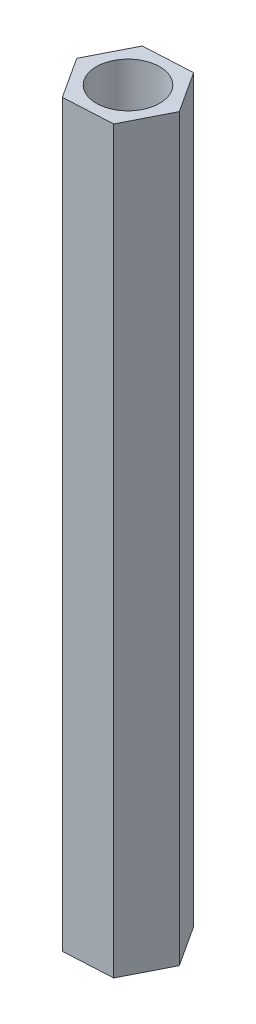
from build123d import *

# Parameters (mm, degrees)
SKETCH_1_R      = 1.5
EXTRUDE_1_DEPTH = 35


with BuildPart() as part:
    # 草图1 → 凸台-拉伸1 (new body)
    with BuildSketch(Plane(origin=(0, 0, 0), x_dir=(1, 0, 0), z_dir=(0, 1, 0))):
        Polygon((1.047736103, 2.058053059), (-1.25845818, 1.936392611), (-2.306194283, -0.121660448), (-1.047736103, -2.058053059), (1.25845818, -1.936392611), (2.306194283, 0.121660448), align=None)
        with Locations(Location((0, 0, 0), (0, 0, 270))):
            Circle(SKETCH_1_R, mode=Mode.SUBTRACT)
    extrude(amount=EXTRUDE_1_DEPTH)


solid = part.part
